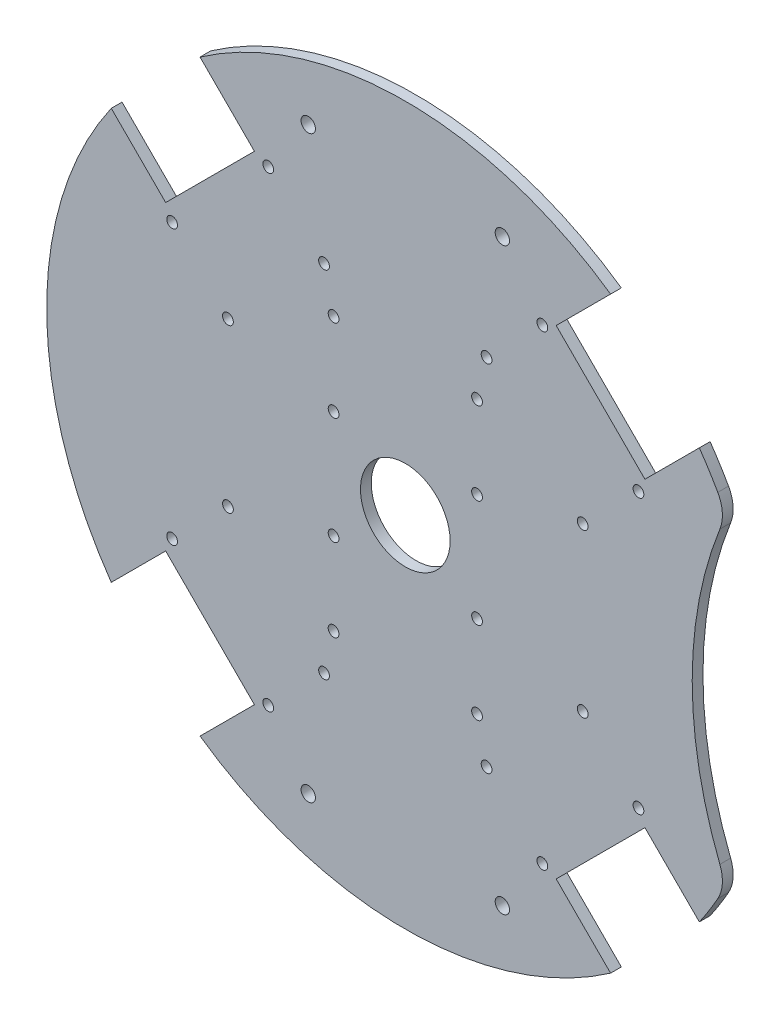
from build123d import *

# Parameters (mm, degrees)
CROQUIS1_R              = 100
SALIENTE_EXTRUIR1_DEPTH = 3
CROQUIS3_R              = 110
CORTAR_EXTRUIR1_DEPTH   = 3
REDONDEO1_R             = 10
CROQUIS4_R              = 1.5
CROQUIS4_R_2            = 12.5
CORTAR_EXTRUIR2_DEPTH   = 142.453172607
CROQUIS5_R              = 1.5
CORTAR_EXTRUIR3_DEPTH   = 142.453172607
CROQUIS7_R              = 2
CORTAR_EXTRUIR5_DEPTH   = 10


with BuildPart() as part:
    # Croquis1 → Saliente-Extruir1 (new body)
    with BuildSketch(Plane.XY):
        Circle(CROQUIS1_R)
    extrude(amount=SALIENTE_EXTRUIR1_DEPTH)

    # Croquis3 → Cortar-Extruir1 (cut)
    with BuildSketch(Plane.XY.offset(3)):
        with Locations((190, 0)):
            Circle(CROQUIS3_R)
    extrude(amount=-CORTAR_EXTRUIR1_DEPTH, mode=Mode.SUBTRACT)

    # Redondeo1
    redondeo1_edges = [part.edges().sort_by_distance(p)[0] for p in [
        (89.473684211, -44.659375654, 1.5),
        (89.473684211, 44.659375654, 1.5),
    ]]
    fillet(redondeo1_edges, radius=REDONDEO1_R)

    # Croquis4 → Cortar-Extruir2 (cut, through all)
    with BuildSketch(Plane.XY.offset(3)):
        with Locations((-65.01846853, -38.219121523)):
            Circle(CROQUIS4_R)
        with Locations((-49.462119344, -22.662772337)):
            Circle(CROQUIS4_R)
        with Locations((-22.662772337, -49.462119344)):
            Circle(CROQUIS4_R)
        with Locations((-38.219121523, -65.01846853)):
            Circle(CROQUIS4_R)
        with Locations((-22.662772337, 49.462119344)):
            Circle(CROQUIS4_R)
        with Locations((-38.219121523, 65.01846853)):
            Circle(CROQUIS4_R)
        with Locations((-49.462119344, 22.662772337)):
            Circle(CROQUIS4_R)
        with Locations((-65.01846853, 38.219121523)):
            Circle(CROQUIS4_R)
        with Locations((49.462119344, 22.662772337)):
            Circle(CROQUIS4_R)
        with Locations((65.01846853, 38.219121523)):
            Circle(CROQUIS4_R)
        with Locations((22.662772337, 49.462119344)):
            Circle(CROQUIS4_R)
        with Locations((38.219121523, 65.01846853)):
            Circle(CROQUIS4_R)
        with Locations((22.662772337, -49.462119344)):
            Circle(CROQUIS4_R)
        with Locations((38.219121523, -65.01846853)):
            Circle(CROQUIS4_R)
        with Locations((49.462119344, -22.662772337)):
            Circle(CROQUIS4_R)
        with Locations((65.01846853, -38.219121523)):
            Circle(CROQUIS4_R)
        Circle(CROQUIS4_R_2)
        Polygon((-58.336309448, -83.085046789), (-83.085046789, -58.336309448), (-66.821590822, -42.072853481), (-42.072853481, -66.821590822), align=None)
        Polygon((-66.821590822, 42.072853481), (-42.072853481, 66.821590822), (-58.336309448, 83.085046789), (-83.085046789, 58.336309448), align=None)
        Polygon((42.072853481, 66.821590822), (66.821590822, 42.072853481), (83.085046789, 58.336309448), (58.336309448, 83.085046789), align=None)
        Polygon((66.821590822, -42.072853481), (42.072853481, -66.821590822), (58.336309448, -83.085046789), (83.085046789, -58.336309448), align=None)
    extrude(amount=-CORTAR_EXTRUIR2_DEPTH, mode=Mode.SUBTRACT)

    # Croquis5 → Cortar-Extruir3 (cut, through all)
    with BuildSketch(Plane(origin=(0, 0, 0), x_dir=(-1, 0, 0), z_dir=(0, 0, -1))):
        with Locations((-20, -38)):
            Circle(CROQUIS5_R)
        with Locations((-20, -15)):
            Circle(CROQUIS5_R)
        with Locations((20, -15)):
            Circle(CROQUIS5_R)
        with Locations((20, -38)):
            Circle(CROQUIS5_R)
        with Locations(Location((-20, 15, 0), (0, 0, 180))):
            Circle(CROQUIS5_R)
        with Locations(Location((-20, 38, 0), (0, 0, 180))):
            Circle(CROQUIS5_R)
        with Locations(Location((20, 38, 0), (0, 0, 180))):
            Circle(CROQUIS5_R)
        with Locations(Location((20, 15, 0), (0, 0, 180))):
            Circle(CROQUIS5_R)
    extrude(amount=-CORTAR_EXTRUIR3_DEPTH, mode=Mode.SUBTRACT)

    # Croquis7 → Cortar-Extruir5 (cut)
    with BuildSketch(Plane(origin=(0, 0, 0), x_dir=(-1, 0, 0), z_dir=(0, 0, -1))):
        with Locations((-27.065, -80.785)):
            Circle(CROQUIS7_R)
        with Locations((27.065, -80.785)):
            Circle(CROQUIS7_R)
        with Locations(Location((27.065, 80.785, 0), (0, 0, 180))):
            Circle(CROQUIS7_R)
        with Locations(Location((-27.065, 80.785, 0), (0, 0, 180))):
            Circle(CROQUIS7_R)
    extrude(amount=-CORTAR_EXTRUIR5_DEPTH, mode=Mode.SUBTRACT)


solid = part.part
